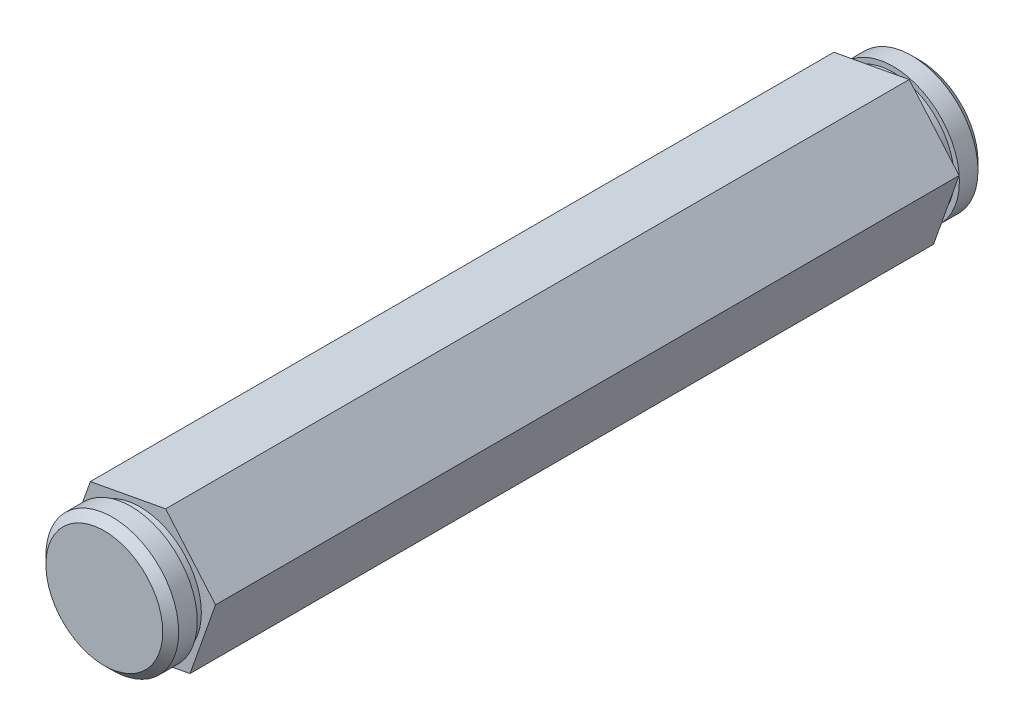
from build123d import *

# Parameters (mm, degrees)
BOSS_EXTRUDE1_DEPTH      = 35.56
SKETCH2_R                = 5.8547
BOSS_EXTRUDE2_DEPTH      = 0.889
SKETCH3_R                = 6.35
BOSS_EXTRUDE3_DEPTH      = 2.54
CHAMFER1_SIZE            = 0.762
CHAMFER1_OF_MIRROR1_SIZE = 0.762


with BuildPart() as part:
    # Sketch1 → Boss-Extrude1 (new, symmetric)
    with BuildSketch(Plane.XY):
        Polygon((-2.440353064, -6.914333681), (4.767812086, -5.570574588), (7.20816515, 1.343759093), (2.440353064, 6.914333681), (-4.767812086, 5.570574588), (-7.20816515, -1.343759093), align=None)
    extrude(amount=BOSS_EXTRUDE1_DEPTH, both=True)

    # Sketch2 → Boss-Extrude2 (add)
    with BuildSketch(Plane.XY.offset(35.56)):
        Circle(SKETCH2_R)
    boss_extrude2 = extrude(amount=BOSS_EXTRUDE2_DEPTH)

    # Sketch3 → Boss-Extrude3 (add)
    with BuildSketch(Plane.XY.offset(36.449)):
        Circle(SKETCH3_R)
    boss_extrude3 = extrude(amount=BOSS_EXTRUDE3_DEPTH)

    # Chamfer1
    chamfer1_edges = [part.edges().sort_by_distance(p)[0] for p in [
        (-6.35, 0, 38.989),
    ]]
    chamfer(chamfer1_edges, length=CHAMFER1_SIZE)

    # Mirror1: Boss-Extrude2, Boss-Extrude3 across plane
    add(boss_extrude2.mirror(Plane.XY))
    add(boss_extrude3.mirror(Plane.XY))

    # Chamfer1 of Mirror1
    chamfer1_of_mirror1_edges = [part.edges().sort_by_distance(p)[0] for p in [
        (-6.35, 0, -38.989),
    ]]
    chamfer(chamfer1_of_mirror1_edges, length=CHAMFER1_OF_MIRROR1_SIZE)


solid = part.part
